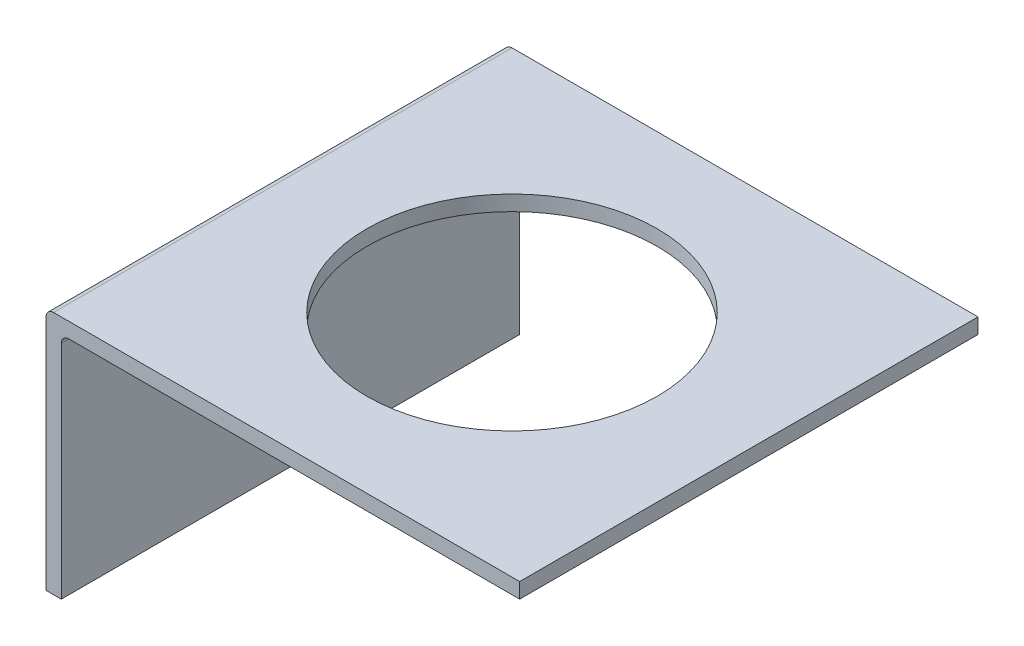
from build123d import *

# Parameters (mm, degrees)
SKETCH1_W           = 62
SKETCH1_H           = 60
BOSS_EXTRUDE1_DEPTH = 2
SKETCH2_W           = 2
SKETCH2_H           = 59.995898743
BOSS_EXTRUDE2_DEPTH = 30
FILLET1_R           = 1
SKETCH3_R           = 19
CUT_EXTRUDE1_DEPTH  = 54.712196008


with BuildPart() as part:
    # Sketch1 → Boss-Extrude1 (new body)
    with BuildSketch(Plane(origin=(0, 0, 0), x_dir=(1, 0, 0), z_dir=(0, 1, 0))):
        Rectangle(SKETCH1_W, SKETCH1_H)
    extrude(amount=BOSS_EXTRUDE1_DEPTH)

    # Sketch2 → Boss-Extrude2 (add)
    with BuildSketch(Plane.XZ):
        with Locations((-30, 0.002050629)):
            Rectangle(SKETCH2_W, SKETCH2_H)
    extrude(amount=BOSS_EXTRUDE2_DEPTH)

    # Fillet1
    fillet1_edges = [part.edges().sort_by_distance(p)[0] for p in [
        (-31, 2, 0),
        (-29, 0, 0.002050628),
    ]]
    fillet(fillet1_edges, radius=FILLET1_R)

    # Sketch3 → Cut-Extrude1 (cut, through all)
    with BuildSketch(Plane(origin=(0, 2, 0), x_dir=(1, 0, 0), z_dir=(0, 1, 0))):
        with Locations(Location((0, 0, 0), (0, 0, 270))):
            Circle(SKETCH3_R)
    extrude(amount=-CUT_EXTRUDE1_DEPTH, mode=Mode.SUBTRACT)


solid = part.part
